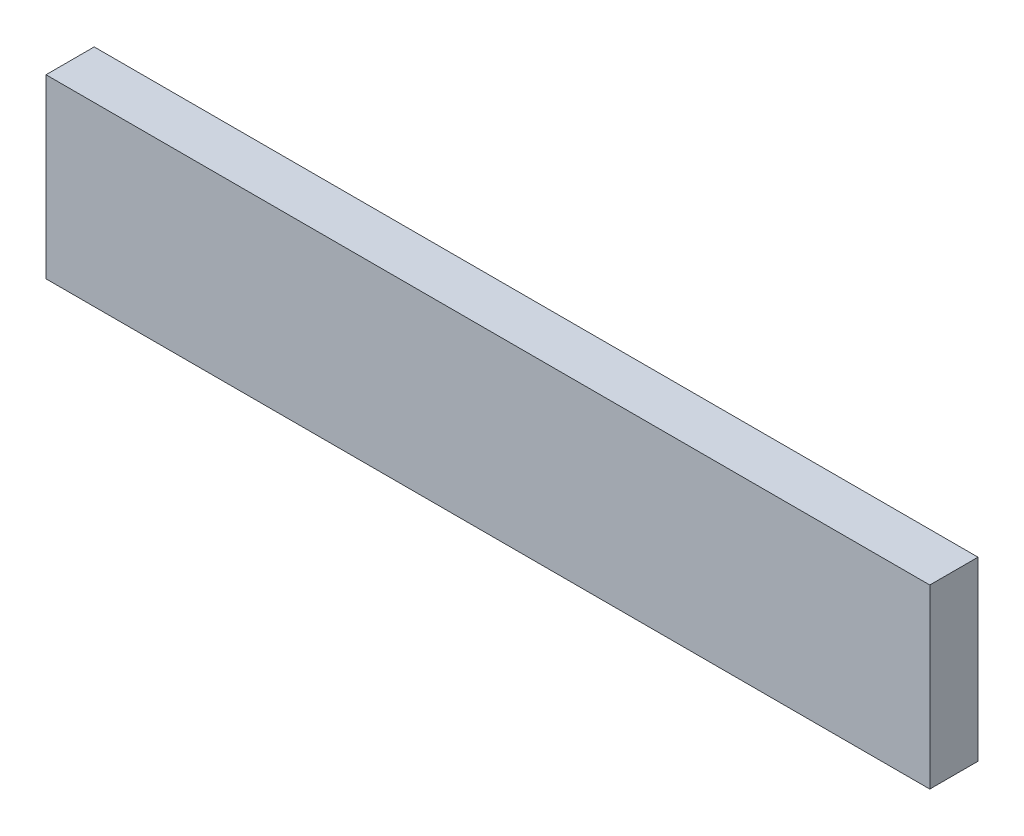
from build123d import *

# Parameters (mm, degrees)
SKETCH1_W           = 55
SKETCH1_H           = 11
BOSS_EXTRUDE1_DEPTH = 3


with BuildPart() as part:
    # Sketch1 → Boss-Extrude1 (new body)
    with BuildSketch(Plane.XY):
        with Locations((27.5, 5.5)):
            Rectangle(SKETCH1_W, SKETCH1_H)
    extrude(amount=BOSS_EXTRUDE1_DEPTH)


solid = part.part
